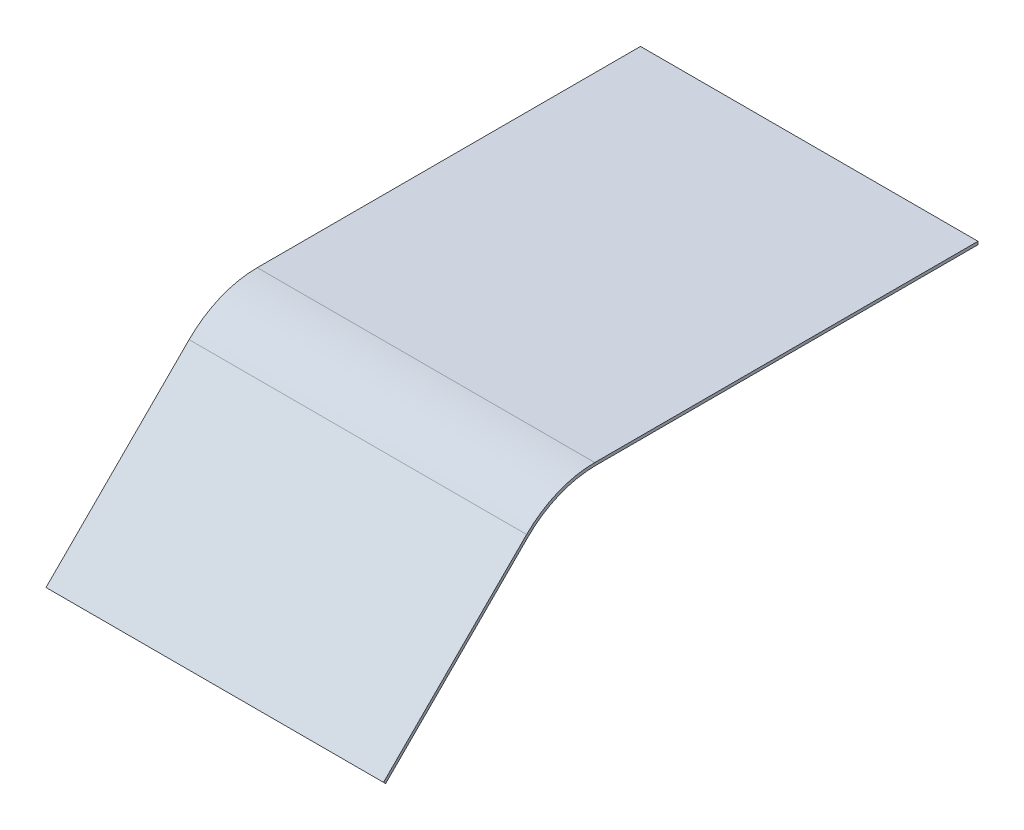
from build123d import *

# Parameters (mm, degrees)
BOSS_EXTRUDE1_DEPTH = 177.8


with BuildPart() as part:
    # Sketch1 → Boss-Extrude1 (new body)
    with BuildSketch(Plane(origin=(0, 0, 0), x_dir=(0, 0, -1), z_dir=(1, 0, 0))):
        with BuildLine():
            Line((21.042048969, 0), (222.25, 0))
            Line((222.25, 0), (222.25, 1.5875))
            Line((222.25, 1.5875), (20.384484938, 1.5875))
            ThreePointArc((20.384484938, 1.5875), (0.944166574, -2.279419748), (-15.536539546, -13.291475516))
            Line((-15.536539546, -13.291475516), (-90.925093226, -88.680029196))
            Line((-90.925093226, -88.680029196), (-89.802561211, -89.802561211))
            Line((-89.802561211, -89.802561211), (-14.878975516, -14.878975516))
            ThreePointArc((-14.878975516, -14.878975516), (1.601730604, -3.866919748), (21.042048969, 0))
        make_face()
    extrude(amount=BOSS_EXTRUDE1_DEPTH)


solid = part.part
